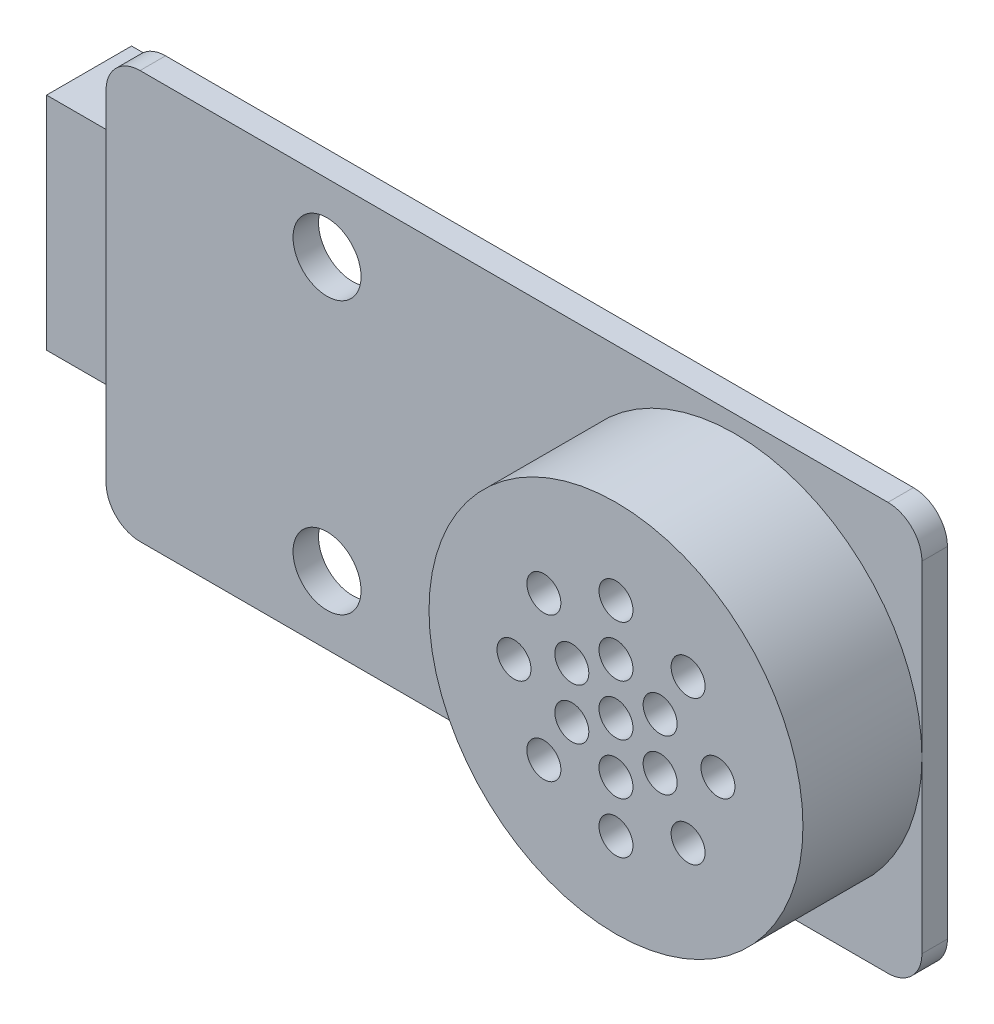
from build123d import *

# Parameters (mm, degrees)
SKETCH_1_W          = 48
SKETCH_1_H          = 24
EXTRUDE_1_DEPTH     = 1.5
FILLET_1_R          = 2
SKETCH_2_R          = 11
EXTRUDE_2_DEPTH     = 7
SKETCH_3_W          = 11
SKETCH_3_H          = 13
EXTRUDE_3_DEPTH     = 5
SKETCH_4_R          = 2
CUT_EXTRUDE_1_DEPTH = 5
SKETCH_5_R          = 1
CUT_EXTRUDE_2_DEPTH = 7


with BuildPart() as part:
    # 草图1 → 凸台-拉伸1 (new body)
    with BuildSketch(Plane.XY):
        Rectangle(SKETCH_1_W, SKETCH_1_H)
    extrude(amount=EXTRUDE_1_DEPTH)

    # 圆角1
    fillet_1_edges = [part.edges().sort_by_distance(p)[0] for p in [
        (24, -12, 0.75),
        (-24, -12, 0.75),
        (-24, 12, 0.75),
        (24, 12, 0.75),
    ]]
    fillet(fillet_1_edges, radius=FILLET_1_R)

    # 草图2 → 凸台-拉伸2 (add)
    with BuildSketch(Plane.XY.offset(1.5)):
        with Locations((13, 0)):
            Circle(SKETCH_2_R)
    extrude(amount=EXTRUDE_2_DEPTH)

    # 草图3 → 凸台-拉伸3 (add)
    with BuildSketch(Plane(origin=(0, 0, 0), x_dir=(-1, 0, 0), z_dir=(0, 0, -1))):
        with Locations((23.5, 0)):
            Rectangle(SKETCH_3_W, SKETCH_3_H)
    extrude(amount=EXTRUDE_3_DEPTH)

    # 草图4 → 切除-拉伸1 (cut)
    with BuildSketch(Plane.XY.offset(1.5)):
        with Locations((-11, 8)):
            Circle(SKETCH_4_R)
        with Locations(Location((-11, -8, 0), (0, 0, 180))):
            Circle(SKETCH_4_R)
    extrude(amount=-CUT_EXTRUDE_1_DEPTH, mode=Mode.SUBTRACT)

    # 草图5 → 切除-拉伸2 (cut)
    with BuildSketch(Plane.XY.offset(8.5)):
        with Locations((13, 0)):
            Circle(SKETCH_5_R)
        with Locations((13, 3)):
            Circle(SKETCH_5_R)
        with Locations((7, 0)):
            Circle(SKETCH_5_R)
        with Locations((15.598076211, 1.5)):
            Circle(SKETCH_5_R)
        with Locations((15.598076211, -1.5)):
            Circle(SKETCH_5_R)
        with Locations((13, -3)):
            Circle(SKETCH_5_R)
        with Locations((10.401923789, -1.5)):
            Circle(SKETCH_5_R)
        with Locations((10.401923789, 1.5)):
            Circle(SKETCH_5_R)
        with Locations((8.757359313, 4.242640687)):
            Circle(SKETCH_5_R)
        with Locations((13, 6)):
            Circle(SKETCH_5_R)
        with Locations((17.242640687, 4.242640687)):
            Circle(SKETCH_5_R)
        with Locations((19, 0)):
            Circle(SKETCH_5_R)
        with Locations((17.242640687, -4.242640687)):
            Circle(SKETCH_5_R)
        with Locations((13, -6)):
            Circle(SKETCH_5_R)
        with Locations((8.757359313, -4.242640687)):
            Circle(SKETCH_5_R)
    extrude(amount=-CUT_EXTRUDE_2_DEPTH, mode=Mode.SUBTRACT)


solid = part.part
